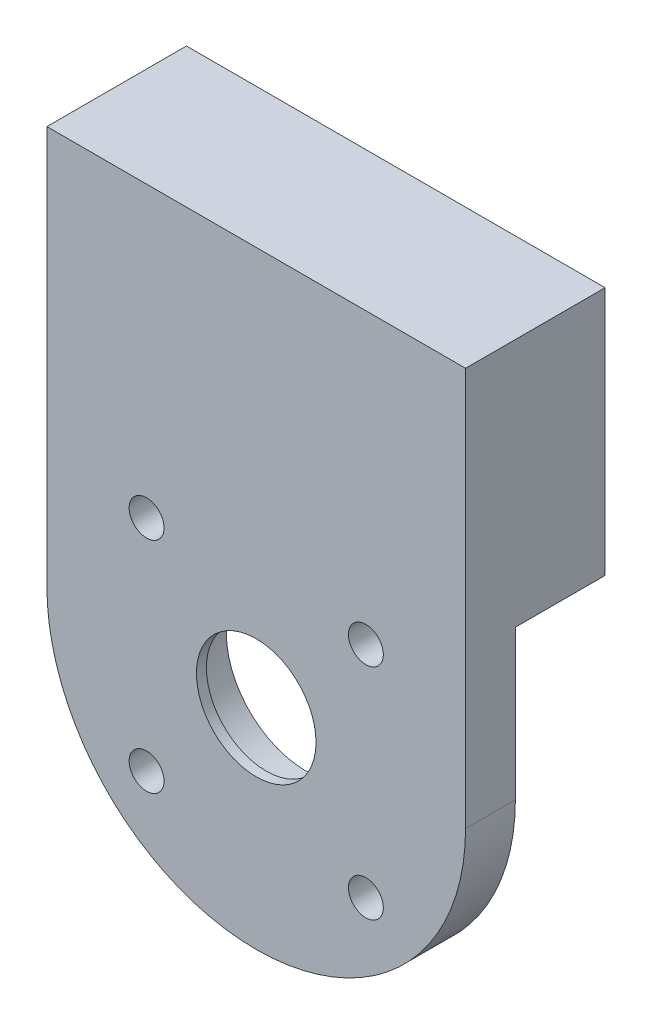
from build123d import *

# Parameters (mm, degrees)
BOSS_EXTRUDE1_DEPTH = 5
SKETCH2_R           = 6
CUT_EXTRUDE1_DEPTH  = 46.453272709
SKETCH3_R           = 8
CUT_EXTRUDE2_DEPTH  = 4
SKETCH4_R           = 1.75
CUT_EXTRUDE3_DEPTH  = 46.453272709
CUT_EXTRUDE4_DEPTH  = 2
SKETCH6_W           = 42
SKETCH6_H           = 25
BOSS_EXTRUDE2_DEPTH = 9
SKETCH7_R           = 22
CUT_EXTRUDE5_DEPTH  = 47.065171225


with BuildPart() as part:
    # Sketch1 → Boss-Extrude1 (new body)
    with BuildSketch(Plane.XY):
        with BuildLine():
            Line((-21, 40), (21, 40))
            Line((21, 40), (21, 0))
            ThreePointArc((21, 0), (0, -21), (-21, 0))
            Line((-21, 0), (-21, 40))
        make_face()
    extrude(amount=BOSS_EXTRUDE1_DEPTH)

    # Sketch2 → Cut-Extrude1 (cut, through all)
    with BuildSketch(Plane.XY.offset(5)):
        Circle(SKETCH2_R)
    extrude(amount=-CUT_EXTRUDE1_DEPTH, mode=Mode.SUBTRACT)

    # Sketch3 → Cut-Extrude2 (cut)
    with BuildSketch(Plane(origin=(0, 0, 0), x_dir=(-1, 0, 0), z_dir=(0, 0, -1))):
        Circle(SKETCH3_R)
    extrude(amount=-CUT_EXTRUDE2_DEPTH, mode=Mode.SUBTRACT)

    # Sketch4 → Cut-Extrude3 (cut, through all)
    with BuildSketch(Plane(origin=(0, 0, 0), x_dir=(-1, 0, 0), z_dir=(0, 0, -1))):
        with Locations((-11, 11)):
            Circle(SKETCH4_R)
        with Locations(Location((-11, -11, 0), (0, 0, 180))):
            Circle(SKETCH4_R)
        with Locations((11, -11)):
            Circle(SKETCH4_R)
        with Locations(Location((11, 11, 0), (0, 0, 180))):
            Circle(SKETCH4_R)
    extrude(amount=-CUT_EXTRUDE3_DEPTH, mode=Mode.SUBTRACT)

    # Sketch5 → Cut-Extrude4 (cut)
    with BuildSketch(Plane(origin=(0, 0, 0), x_dir=(-1, 0, 0), z_dir=(0, 0, -1))):
        Polygon((-11, 14.290896534), (-13.85, 12.645448267), (-13.85, 9.354551733), (-11, 7.709103466), (-8.15, 9.354551733), (-8.15, 12.645448267), align=None)
        Polygon((-8.15, -12.645448267), (-11, -14.290896534), (-13.85, -12.645448267), (-13.85, -9.354551733), (-11, -7.709103466), (-8.15, -9.354551733), align=None)
        Polygon((11, -14.290896534), (13.85, -12.645448267), (13.85, -9.354551733), (11, -7.709103466), (8.15, -9.354551733), (8.15, -12.645448267), align=None)
        Polygon((8.15, 12.645448267), (11, 14.290896534), (13.85, 12.645448267), (13.85, 9.354551733), (11, 7.709103466), (8.15, 9.354551733), align=None)
    extrude(amount=-CUT_EXTRUDE4_DEPTH, mode=Mode.SUBTRACT)

    # Sketch6 → Boss-Extrude2 (add)
    with BuildSketch(Plane(origin=(0, 0, 0), x_dir=(-1, 0, 0), z_dir=(0, 0, -1))):
        with Locations((0, 27.5)):
            Rectangle(SKETCH6_W, SKETCH6_H)
    extrude(amount=BOSS_EXTRUDE2_DEPTH)

    # Sketch7 → Cut-Extrude5 (cut, through all)
    with BuildSketch(Plane(origin=(0, 0, 0), x_dir=(-1, 0, 0), z_dir=(0, 0, -1))):
        Circle(SKETCH7_R)
    extrude(amount=CUT_EXTRUDE5_DEPTH, mode=Mode.SUBTRACT)


solid = part.part
